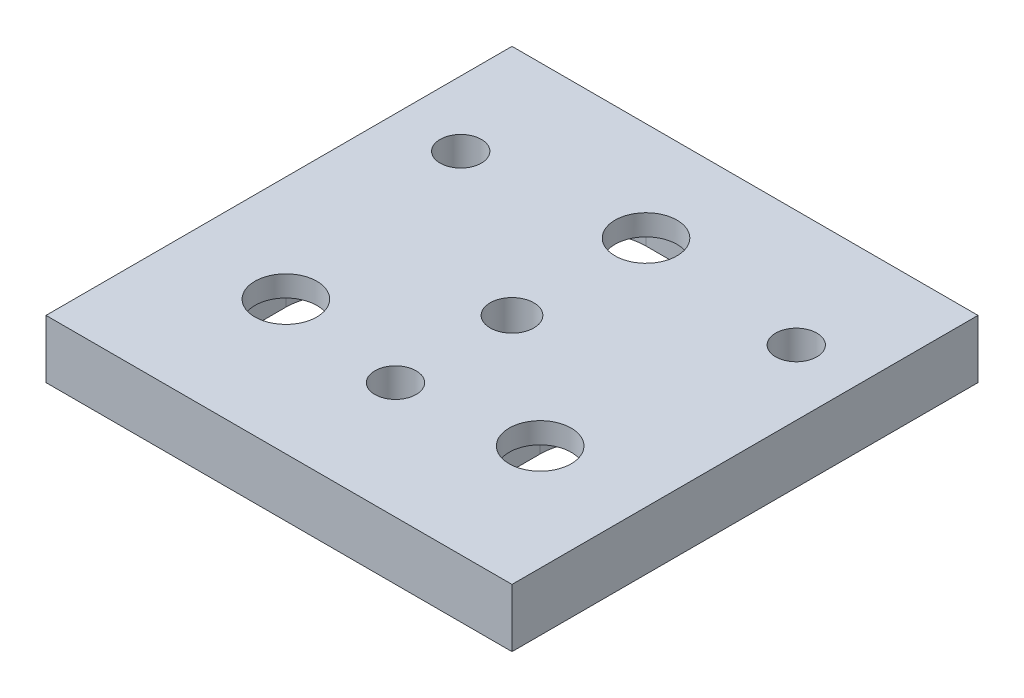
from build123d import *

# Parameters (mm, degrees)
SKETCH1_W               = 50.8
SKETCH1_H               = 50.8
BOSS_EXTRUDE1_DEPTH     = 6.35
F_8_CLEARANCE_HOLE1_D   = 4.4958
F_1_4_CLEARANCE_HOLE1_D = 6.7564
CUT_EXTRUDE1_DEPTH      = 4.064
SKETCH9_R               = 2.38125
CUT_EXTRUDE2_DEPTH      = 37.477972806


with BuildPart() as part:
    # Sketch1 → Boss-Extrude1 (new body)
    with BuildSketch(Plane(origin=(0, 0, 0), x_dir=(1, 0, 0), z_dir=(0, 1, 0))):
        Rectangle(SKETCH1_W, SKETCH1_H)
    extrude(amount=BOSS_EXTRUDE1_DEPTH)

    # #8 Clearance Hole1 (through all)
    with Locations(Plane(origin=(0, 6.35, 0), x_dir=(1, 0, 0), z_dir=(0, 1, 0))):
        with Locations((-18.288, 12.7), (18.288, 12.7), (0, -12.7)):
            Hole(F_8_CLEARANCE_HOLE1_D / 2)

    # 1/4 Clearance Hole1 (through all)
    with Locations(Plane(origin=(0, 6.35, 0), x_dir=(1, 0, 0), z_dir=(0, 1, 0))):
        with Locations((0, 14.61008), (-13.86078, -10.78992), (13.86078, -10.78992)):
            Hole(F_1_4_CLEARANCE_HOLE1_D / 2)

    # Sketch8 → Cut-Extrude1 (cut)
    with BuildSketch(Plane.XZ):
        with BuildLine():
            Line((-19.44878, 16.37792), (-19.44878, 5.20192))
            ThreePointArc((-19.44878, 5.20192), (-13.86078, -0.38608), (-8.27278, 5.20192))
            Line((-8.27278, 5.20192), (-8.27278, 16.37792))
            ThreePointArc((-8.27278, 16.37792), (-13.86078, 21.96592), (-19.44878, 16.37792))
        make_face()
        with BuildLine():
            Line((8.27278, 16.37792), (8.27278, 5.20192))
            ThreePointArc((8.27278, 5.20192), (13.86078, -0.38608), (19.44878, 5.20192))
            Line((19.44878, 5.20192), (19.44878, 16.37792))
            ThreePointArc((19.44878, 16.37792), (13.86078, 21.96592), (8.27278, 16.37792))
        make_face()
        with BuildLine():
            Line((-5.588, -9.02208), (5.588, -9.02208))
            ThreePointArc((5.588, -9.02208), (11.176, -14.61008), (5.588, -20.19808))
            Line((5.588, -20.19808), (-5.588, -20.19808))
            ThreePointArc((-5.588, -20.19808), (-11.176, -14.61008), (-5.588, -9.02208))
        make_face()
    extrude(amount=-CUT_EXTRUDE1_DEPTH, mode=Mode.SUBTRACT)

    # Sketch9 → Cut-Extrude2 (cut, through all)
    with BuildSketch(Plane(origin=(0, 6.35, 0), x_dir=(1, 0, 0), z_dir=(0, 1, 0))):
        with Locations(Location((0, 0, 0), (0, 0, 270))):
            Circle(SKETCH9_R)
    extrude(amount=-CUT_EXTRUDE2_DEPTH, mode=Mode.SUBTRACT)


solid = part.part
